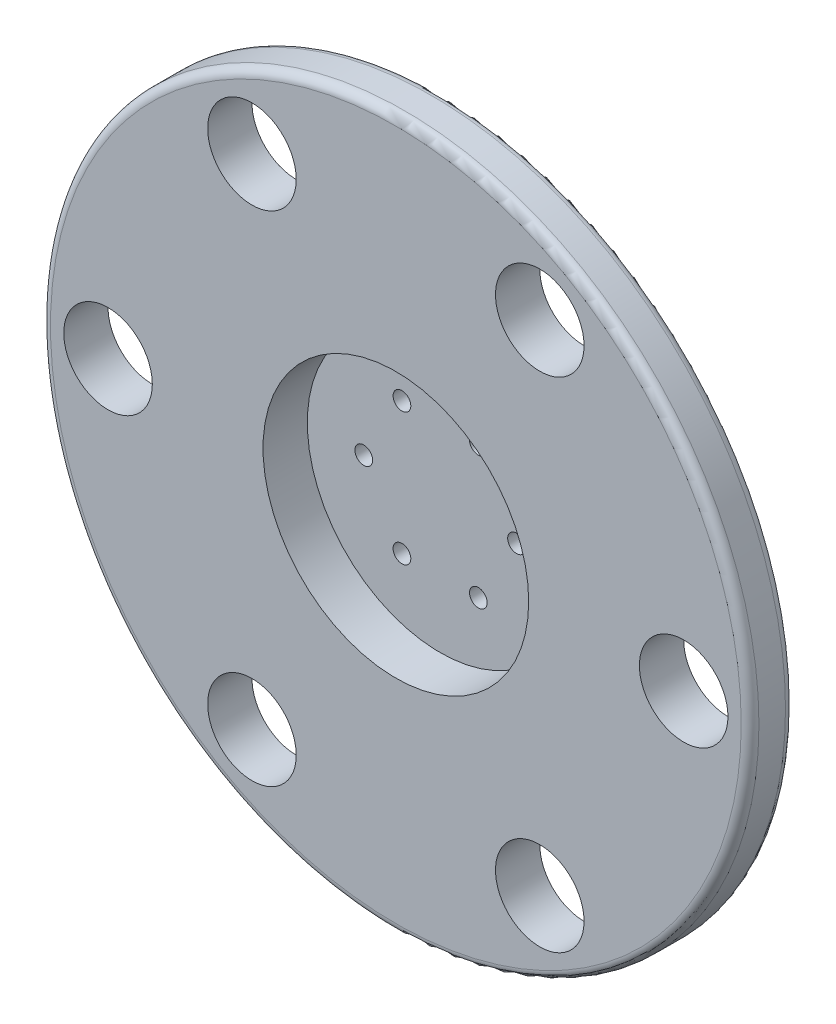
from build123d import *

# Parameters (mm, degrees)
SKETCH_2_R          = 80
EXTRUDE_1_DEPTH     = 10
SKETCH_3_R          = 32.5
EXTRUDE_2_DEPTH     = 10
SKETCH_4_R          = 2
CUT_EXTRUDE_1_DEPTH = 10
SKETCH_5_R          = 30
CUT_EXTRUDE_2_DEPTH = 10
SKETCH_6_R          = 10
CUT_EXTRUDE_3_DEPTH = 10
FILLET_1_R          = 2


with BuildPart() as part:
    # 草图2 → 凸台-拉伸1 (new body)
    with BuildSketch(Plane.XY):
        Circle(SKETCH_2_R)
    extrude(amount=EXTRUDE_1_DEPTH)

    # 草图3 → 凸台-拉伸2 (add)
    with BuildSketch(Plane.XY):
        Circle(SKETCH_3_R)
    extrude(amount=-EXTRUDE_2_DEPTH)

    # 草图4 → 切除-拉伸1 (cut)
    with BuildSketch(Plane.XY):
        with Locations((-17.25, 0)):
            Circle(SKETCH_4_R)
        with Locations((-8.625, 14.938938215)):
            Circle(SKETCH_4_R)
        with Locations((8.625, 14.938938215)):
            Circle(SKETCH_4_R)
        with Locations((17.25, 0)):
            Circle(SKETCH_4_R)
        with Locations((8.625, -14.938938215)):
            Circle(SKETCH_4_R)
        with Locations((-8.625, -14.938938215)):
            Circle(SKETCH_4_R)
    extrude(amount=-CUT_EXTRUDE_1_DEPTH, mode=Mode.SUBTRACT)

    # 草图5 → 切除-拉伸2 (cut)
    with BuildSketch(Plane.XY):
        Circle(SKETCH_5_R)
    extrude(amount=CUT_EXTRUDE_2_DEPTH, mode=Mode.SUBTRACT)

    # 草图6 → 切除-拉伸3 (cut)
    with BuildSketch(Plane.XY):
        with Locations((-65, 0)):
            Circle(SKETCH_6_R)
        with Locations((-32.5, 56.291651246)):
            Circle(SKETCH_6_R)
        with Locations((32.5, 56.291651246)):
            Circle(SKETCH_6_R)
        with Locations((65, 0)):
            Circle(SKETCH_6_R)
        with Locations((32.5, -56.291651246)):
            Circle(SKETCH_6_R)
        with Locations((-32.5, -56.291651246)):
            Circle(SKETCH_6_R)
    extrude(amount=CUT_EXTRUDE_3_DEPTH, mode=Mode.SUBTRACT)

    # 圆角1
    fillet_1_edges = [part.edges().sort_by_distance(p)[0] for p in [
        (-80, 0, 0),
        (-80, 0, 10),
    ]]
    fillet(fillet_1_edges, radius=FILLET_1_R)


solid = part.part
